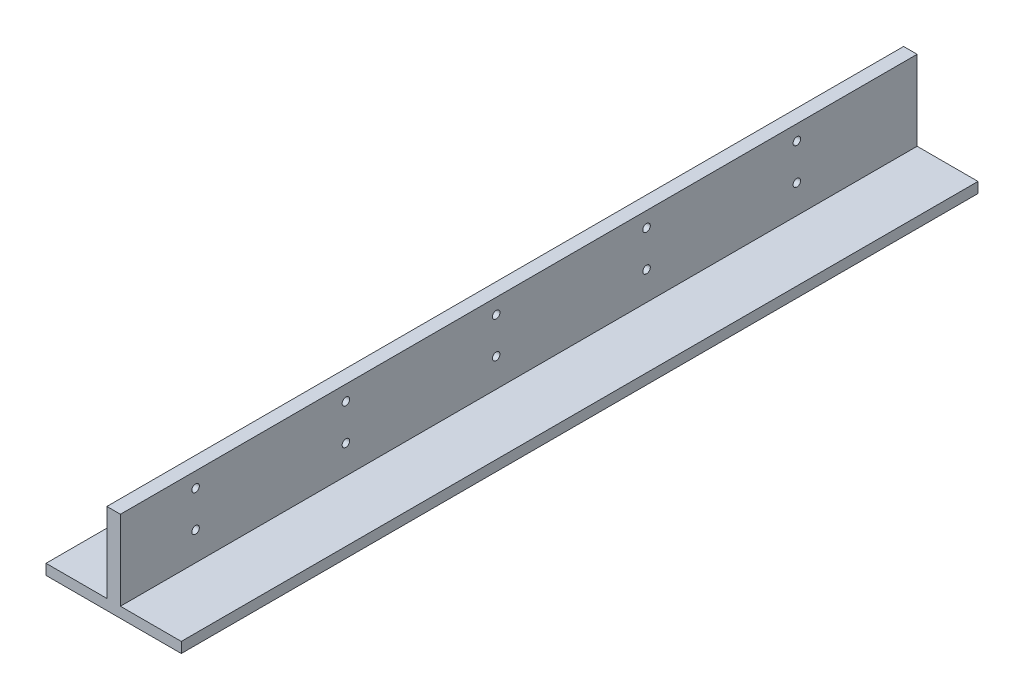
from build123d import *

# Parameters (mm, degrees)
BOSS_EXTRU_1_DEPTH      = 530
ESQUISSE2_R             = 2.5
ENL_V_MAT_EXTRU_1_DEPTH = 9


with BuildPart() as part:
    # Esquisse1 → Boss.-Extru.1 (new body)
    with BuildSketch(Plane.XY):
        Polygon((0, 0), (90, 0), (90, 7), (49.5, 7), (49.5, 60), (40.5, 60), (40.5, 7), (0, 7), align=None)
    extrude(amount=BOSS_EXTRU_1_DEPTH)

    # Esquisse2 → Enlèv. mat.-Extru.1 (cut)
    with BuildSketch(Plane.ZY.offset(-40.5)):
        with Locations(Location((80, 50, 0), (0, 0, 270))):
            Circle(ESQUISSE2_R)
        with Locations(Location((80, 26, 0), (0, 0, 90))):
            Circle(ESQUISSE2_R)
        with Locations(Location((180, 50, 0), (0, 0, 270))):
            Circle(ESQUISSE2_R)
        with Locations(Location((180, 26, 0), (0, 0, 90))):
            Circle(ESQUISSE2_R)
        with Locations(Location((280, 50, 0), (0, 0, 270))):
            Circle(ESQUISSE2_R)
        with Locations(Location((280, 26, 0), (0, 0, 90))):
            Circle(ESQUISSE2_R)
        with Locations(Location((380, 50, 0), (0, 0, 270))):
            Circle(ESQUISSE2_R)
        with Locations(Location((380, 26, 0), (0, 0, 90))):
            Circle(ESQUISSE2_R)
        with Locations(Location((480, 50, 0), (0, 0, 270))):
            Circle(ESQUISSE2_R)
        with Locations(Location((480, 26, 0), (0, 0, 90))):
            Circle(ESQUISSE2_R)
    extrude(amount=-ENL_V_MAT_EXTRU_1_DEPTH, mode=Mode.SUBTRACT)


solid = part.part
